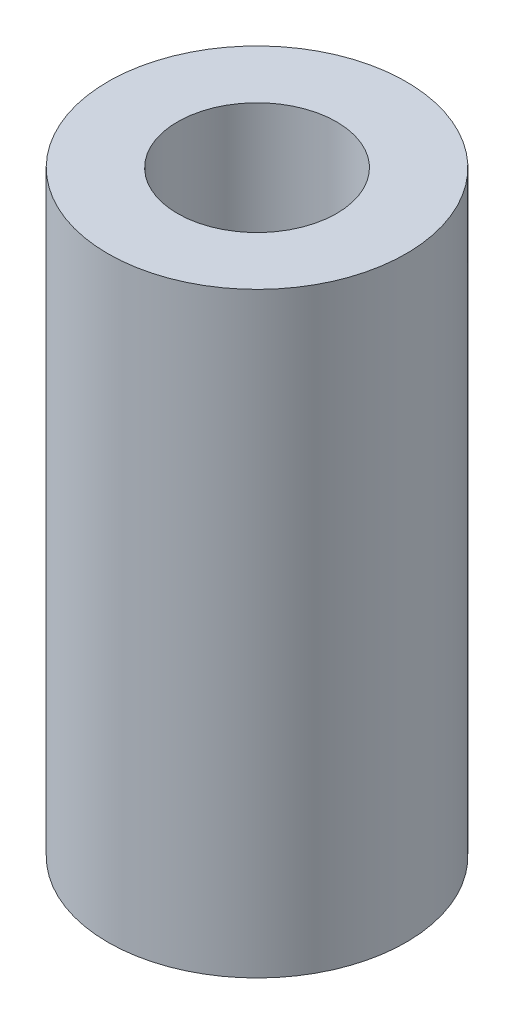
from build123d import *

# Parameters (mm, degrees)
CROQUIS1_R              = 7.5
CROQUIS1_R_2            = 4
SALIENTE_EXTRUIR1_DEPTH = 30
CROQUIS2_W              = 6.9
CROQUIS2_H              = 3.426383691
SALIENTE_EXTRUIR2_DEPTH = 20
CROQUIS3_R              = 3.925
CORTAR_EXTRUIR1_DEPTH   = 20


with BuildPart() as part:
    # Croquis1 → Saliente-Extruir1 (new body)
    with BuildSketch(Plane(origin=(0, 0, 0), x_dir=(1, 0, 0), z_dir=(0, 1, 0))):
        with Locations(Location((0, 0, 0), (0, 0, 270))):
            Circle(CROQUIS1_R)
        with Locations(Location((0, 0, 0), (0, 0, 270))):
            Circle(CROQUIS1_R_2, mode=Mode.SUBTRACT)
    extrude(amount=SALIENTE_EXTRUIR1_DEPTH)

    # Croquis2 → Saliente-Extruir2 (add)
    with BuildSketch(Plane.XZ):
        with Locations((0, 4.613191846)):
            Rectangle(CROQUIS2_W, CROQUIS2_H)
    extrude(amount=-SALIENTE_EXTRUIR2_DEPTH)

    # Croquis3 → Cortar-Extruir1 (cut)
    with BuildSketch(Plane(origin=(0, 30, 0), x_dir=(1, 0, 0), z_dir=(0, 1, 0))):
        Circle(CROQUIS3_R)
    extrude(amount=-CORTAR_EXTRUIR1_DEPTH, mode=Mode.SUBTRACT)


solid = part.part
